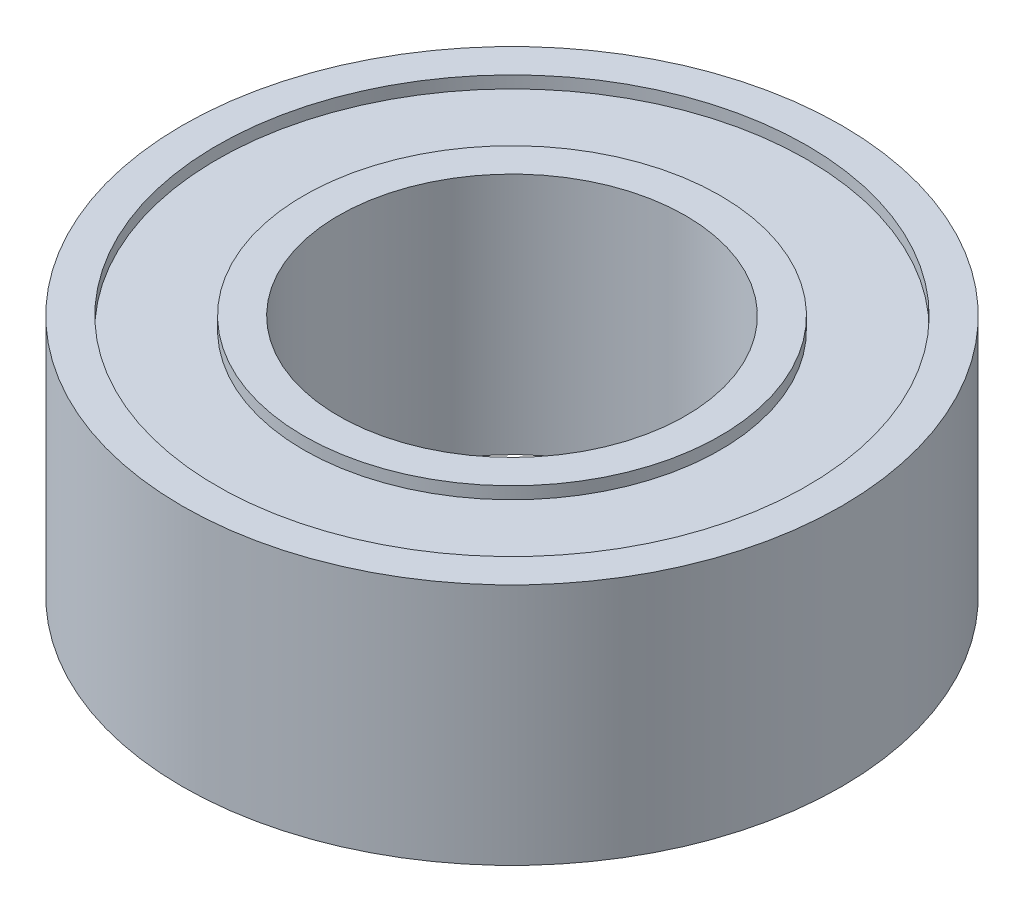
from build123d import *


with BuildPart() as part:
    # 草图2 → 旋转1 (revolve)
    with BuildSketch(Plane.XY, mode=Mode.PRIVATE) as revolve_1_sk:
        Polygon((5, 3.5), (5, -3.5), (6, -3.5), (6, -3.15), (8.5, -3.15), (8.5, -3.5), (9.5, -3.5), (9.5, 3.5), (8.5, 3.5), (8.5, 3.15), (6, 3.15), (6, 3.5), align=None)
    revolve(revolve_1_sk.sketch.rotate(Axis((0, 0, 0), (0, 1, 0)), 90), axis=Axis((0, 0, 0), (0, 1, 0)))


solid = part.part
